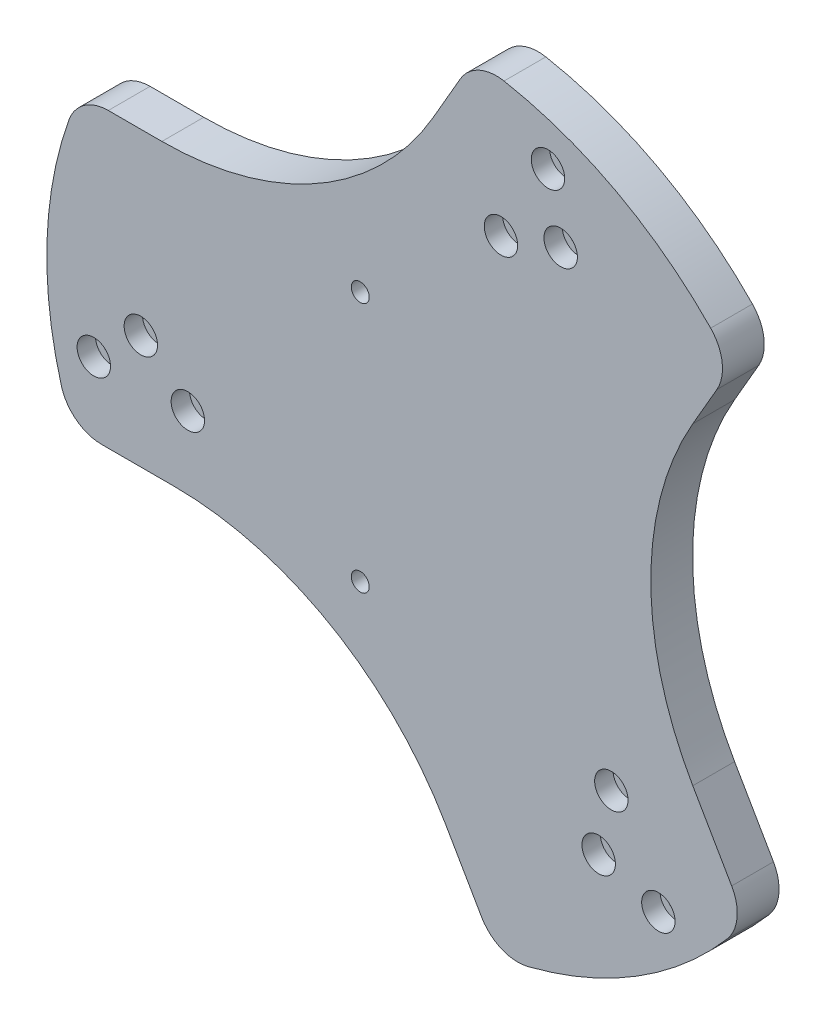
from build123d import *

# Parameters (mm, degrees)
SKIZZE1_R                                            = 92.5
AUFSATZ_LINEAR_AUSTRAGEN1_DEPTH                      = 10
STIRNSENKUNG_F_R_M4_ZYLINDERSCHRAUBE_MIT_D           = 4.5
STIRNSENKUNG_F_R_M4_ZYLINDERSCHRAUBE_MIT_CBORE_D     = 8
STIRNSENKUNG_F_R_M4_ZYLINDERSCHRAUBE_MIT_CBORE_DEPTH = 4.4
SKIZZE10_OUTSIDE_W                                   = 239.364
SKIZZE10_OUTSIDE_H                                   = 239.364
SCHNITT_LINEAR_AUSTRAGEN1_DEPTH                      = 132.196417634
VERRUNDUNG2_R                                        = 10
VERRUNDUNG3_R                                        = 75
SCHNITT_LINEAR_AUSTRAGEN2_REACH                      = 132.221
SKIZZE14_R                                           = 2.15
SKIZZE15_R                                           = 4
SCHNITT_LINEAR_AUSTRAGEN3_DEPTH                      = 4.4
M3_GEWINDEBOHRUNG1_D                                 = 2.5
M3_GEWINDEBOHRUNG1_DEPTH                             = 8.5
M3_GEWINDEBOHRUNG1_TIP                               = 0.751075774


with BuildPart() as part:
    # Skizze1 → Aufsatz-Linear austragen1 (new body)
    with BuildSketch(Plane.XY):
        Circle(SKIZZE1_R)
    extrude(amount=AUFSATZ_LINEAR_AUSTRAGEN1_DEPTH)

    # Stirnsenkung für M4 Zylinderschraube mit Innensechskant1 (through all)
    with Locations(Plane(origin=(-81.25, -15.25, 10), x_dir=(1, 0, 0), z_dir=(0, 0, 1))):
        with Locations((0, 0), (22.5, 0), (97.418112592, 73.753992472), (108.668112592, 93.239564057), (123.831887408, -28.003992472), (135.081887408, -47.489564057), (120.79663337, -42.746778265), (111.70336663, 78.496778265), (11.25, 10)):
            CounterBoreHole(STIRNSENKUNG_F_R_M4_ZYLINDERSCHRAUBE_MIT_D / 2, STIRNSENKUNG_F_R_M4_ZYLINDERSCHRAUBE_MIT_CBORE_D / 2, STIRNSENKUNG_F_R_M4_ZYLINDERSCHRAUBE_MIT_CBORE_DEPTH)

    # Skizze10 outside → Schnitt-Linear austragen1 (cut, through all)
    with BuildSketch(Plane(origin=(0, 0, 0), x_dir=(-1, 0, 0), z_dir=(0, 0, -1))):
        Rectangle(SKIZZE10_OUTSIDE_W, SKIZZE10_OUTSIDE_H)
        with BuildLine():
            Line((86.602540378, -32.5), (18.763883749, -32.5))
            Line((18.763883749, -32.5), (-15.155444566, -91.25))
            ThreePointArc((-15.155444566, -91.25), (-48.569408387, -78.722694116), (-74.754788955, -54.479092579))
            Line((-74.754788955, -54.479092579), (-40.414518843, 5))
            Line((-40.414518843, 5), (-71.447095812, 58.75))
            ThreePointArc((-71.447095812, 58.75), (-43.891148765, 81.423688568), (-9.802883671, 91.979092579))
            Line((-9.802883671, 91.979092579), (21.650635095, 37.5))
            Line((21.650635095, 37.5), (84.557672626, 37.5))
            ThreePointArc((84.557672626, 37.5), (92.460557153, 2.700994452), (86.602540378, -32.5))
        make_face(mode=Mode.SUBTRACT)
    extrude(amount=-SCHNITT_LINEAR_AUSTRAGEN1_DEPTH, mode=Mode.SUBTRACT)

    # Verrundung2
    verrundung2_edges = [part.edges().sort_by_distance(p)[0] for p in [
        (15.155444566, -91.25, 5),
        (74.754788955, -54.479092579, 5),
        (71.447095812, 58.75, 5),
        (9.802883671, 91.979092579, 5),
        (-84.557672626, 37.5, 5),
        (-86.602540378, -32.5, 5),
    ]]
    fillet(verrundung2_edges, radius=VERRUNDUNG2_R)

    # Verrundung3
    verrundung3_edges = [part.edges().sort_by_distance(p)[0] for p in [
        (-18.763883749, -32.5, 5),
        (40.414518843, 5, 5),
        (-21.650635095, 37.5, 5),
    ]]
    fillet(verrundung3_edges, radius=VERRUNDUNG3_R)

    # Skizze14 → Schnitt-Linear austragen2 (cut, up to next)
    with BuildSketch(Plane.XY.offset(10), mode=Mode.PRIVATE) as schnitt_linear_austragen2_sk1:
        with Locations((-17.5, 30)):
            Circle(SKIZZE14_R)
    schnitt_linear_austragen2_tool1 = extrude(schnitt_linear_austragen2_sk1.sketch, amount=-SCHNITT_LINEAR_AUSTRAGEN2_REACH, mode=Mode.PRIVATE) & part.part
    # Skizze14 → Schnitt-Linear austragen2 (cut, up to next)
    with BuildSketch(Plane.XY.offset(10), mode=Mode.PRIVATE) as schnitt_linear_austragen2_sk2:
        with Locations((-17.5, -30)):
            Circle(SKIZZE14_R)
    schnitt_linear_austragen2_tool2 = extrude(schnitt_linear_austragen2_sk2.sketch, amount=-SCHNITT_LINEAR_AUSTRAGEN2_REACH, mode=Mode.PRIVATE) & part.part
    add(schnitt_linear_austragen2_tool1.solids().sort_by_distance((-17.5, 30, 10))[0], mode=Mode.SUBTRACT)
    add(schnitt_linear_austragen2_tool2.solids().sort_by_distance((-17.5, -30, 10))[0], mode=Mode.SUBTRACT)

    # Skizze15 → Schnitt-Linear austragen3 (cut)
    with BuildSketch(Plane(origin=(0, 0, 0), x_dir=(-1, 0, 0), z_dir=(0, 0, -1))):
        with Locations((17.5, 30)):
            Circle(SKIZZE15_R)
        with Locations((17.5, -30)):
            Circle(SKIZZE15_R)
    extrude(amount=-SCHNITT_LINEAR_AUSTRAGEN3_DEPTH, mode=Mode.SUBTRACT)

    # M3 Gewindebohrung1
    with Locations(Plane(origin=(0, 0, 0), x_dir=(-1, 0, 0), z_dir=(0, 0, -1))):
        with Locations((82.5, -4.5), (82.5, 14.5), (-45.147114317, -69.197095812), (-28.692631645, -78.697095812), (-37.352885683, 73.697095812), (-53.807368355, 64.197095812), (0, 0)):
            Hole(M3_GEWINDEBOHRUNG1_D / 2, depth=M3_GEWINDEBOHRUNG1_DEPTH)
            with Locations((0, 0, -(M3_GEWINDEBOHRUNG1_DEPTH + M3_GEWINDEBOHRUNG1_TIP / 2))):  # 118° drill point
                Cone(0, M3_GEWINDEBOHRUNG1_D / 2, M3_GEWINDEBOHRUNG1_TIP, mode=Mode.SUBTRACT)


solid = part.part
